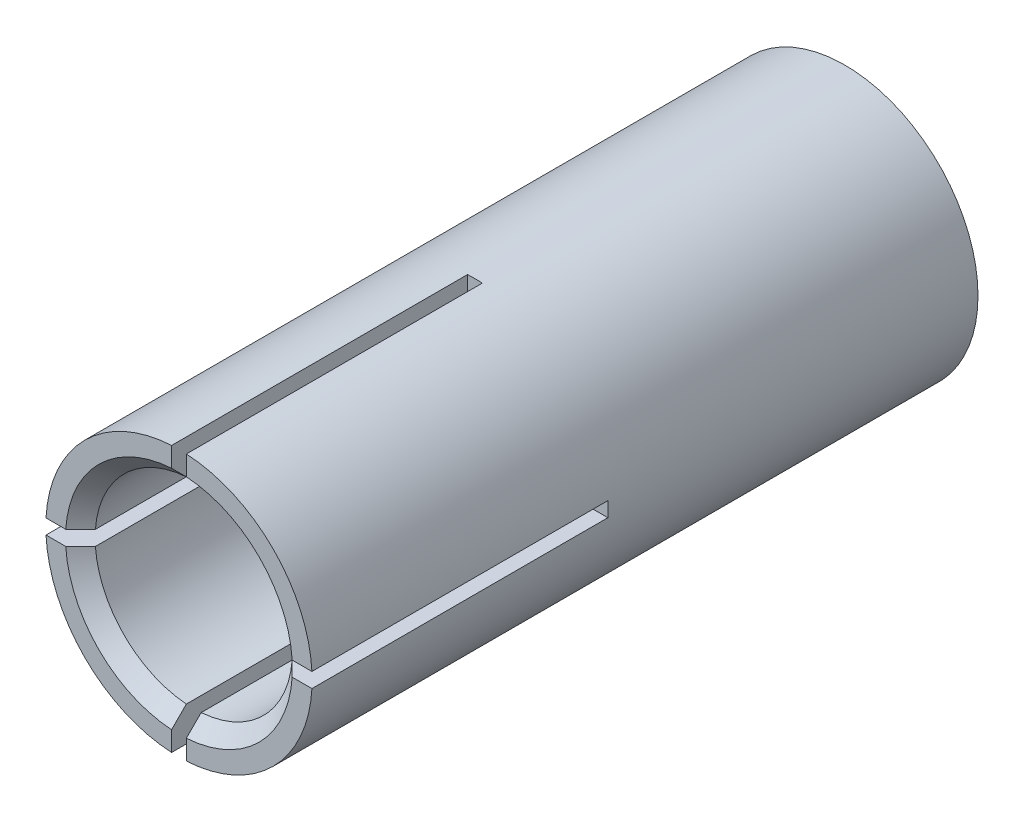
from build123d import *

# Parameters (mm, degrees)
SKETCH1_R           = 9
BOSS_EXTRUDE1_DEPTH = 45
SKETCH2_R           = 6.6675
CUT_EXTRUDE1_DEPTH  = 40
CHAMFER1_SIZE       = 1
SKETCH3_W           = 22.613634382
SKETCH3_H           = 1
SKETCH3_W_2         = 1
SKETCH3_H_2         = 23.145081594
CUT_EXTRUDE2_DEPTH  = 20


with BuildPart() as part:
    # Sketch1 → Boss-Extrude1 (new body)
    with BuildSketch(Plane.XY):
        with Locations(Location((0, 0, 0), (0, 0, 180))):
            Circle(SKETCH1_R)
    extrude(amount=BOSS_EXTRUDE1_DEPTH)

    # Sketch2 → Cut-Extrude1 (cut)
    with BuildSketch(Plane.XY.offset(45)):
        Circle(SKETCH2_R)
    extrude(amount=-CUT_EXTRUDE1_DEPTH, mode=Mode.SUBTRACT)

    # Chamfer1
    chamfer1_edges = [part.edges().sort_by_distance(p)[0] for p in [
        (-6.6675, 0, 45),
    ]]
    chamfer(chamfer1_edges, length=CHAMFER1_SIZE)

    # Sketch3 → Cut-Extrude2 (cut)
    with BuildSketch(Plane.XY.offset(45)):
        Rectangle(SKETCH3_W, SKETCH3_H)
        Rectangle(SKETCH3_W_2, SKETCH3_H_2)
    extrude(amount=-CUT_EXTRUDE2_DEPTH, mode=Mode.SUBTRACT)


solid = part.part
